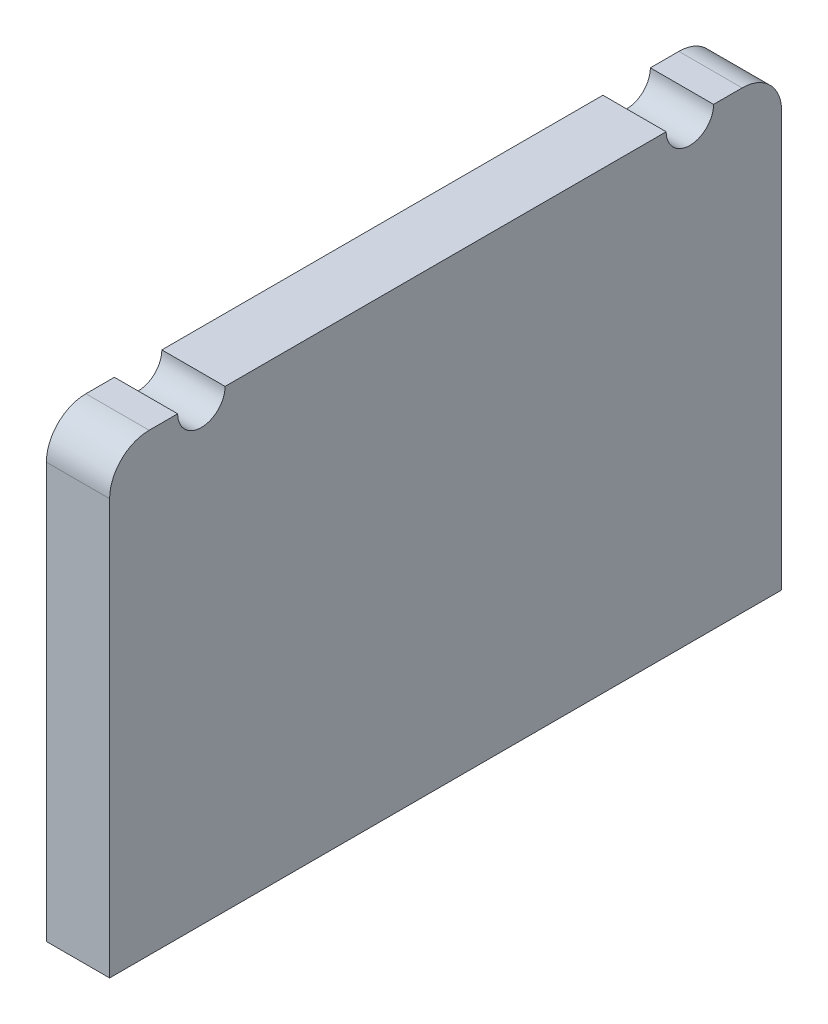
from build123d import *

# Parameters (mm, degrees)
BOSS_EXTRUDE1_DEPTH = 10.16


with BuildPart() as part:
    # Sketch1 → Boss-Extrude1 (new body)
    with BuildSketch(Plane(origin=(0, 0, 0), x_dir=(0, 0, -1), z_dir=(1, 0, 0))):
        with BuildLine():
            Line((-53.975, -36.5125), (53.975, -36.5125))
            Line((53.975, -36.5125), (53.975, 30.1625))
            ThreePointArc((53.975, 30.1625), (52.115128061, 34.652628061), (47.625, 36.5125))
            Line((47.625, 36.5125), (43.045928132, 36.5125))
            ThreePointArc((43.045928132, 36.5125), (39.235928132, 32.7025), (35.425928132, 36.5125))
            Line((35.425928132, 36.5125), (-35.425928132, 36.5125))
            ThreePointArc((-35.425928132, 36.5125), (-39.235928132, 32.7025), (-43.045928132, 36.5125))
            Line((-43.045928132, 36.5125), (-47.625, 36.5125))
            ThreePointArc((-47.625, 36.5125), (-52.115128061, 34.652628061), (-53.975, 30.1625))
            Line((-53.975, 30.1625), (-53.975, -36.5125))
        make_face()
    extrude(amount=BOSS_EXTRUDE1_DEPTH)


solid = part.part
